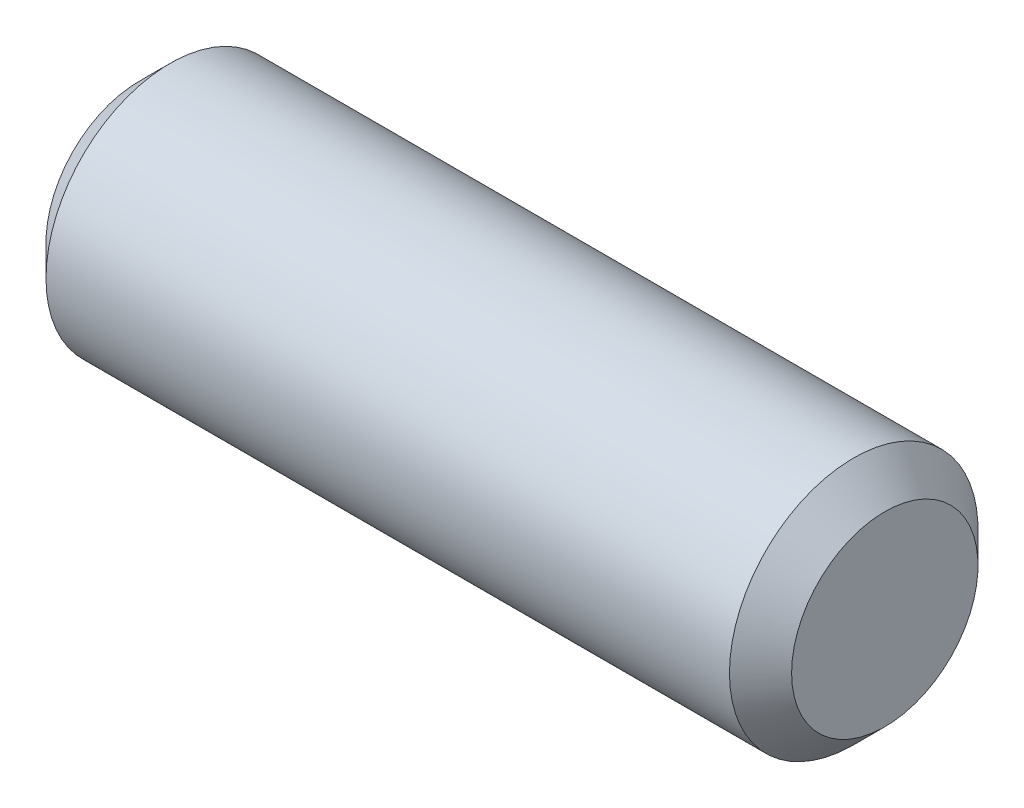
from build123d import *

# Parameters (mm, degrees)
SKETCH_1_W     = 24
SKETCH_1_H     = 4
CHAMFER_1_SIZE = 1


with BuildPart() as part:
    # 草圖1 → 旋轉1 (revolve)
    with BuildSketch(Plane.XY, mode=Mode.PRIVATE) as revolve_1_sk:
        with Locations((12, 2)):
            Rectangle(SKETCH_1_W, SKETCH_1_H)
    revolve(revolve_1_sk.sketch.rotate(Axis((0, 0, 0), (1, 0, 0)), 90), axis=Axis((0, 0, 0), (1, 0, 0)))

    # 導角1
    chamfer_1_edges = [part.edges().sort_by_distance(p)[0] for p in [
        (24, 0, -4),
        (0, 0, -4),
    ]]
    chamfer(chamfer_1_edges, length=CHAMFER_1_SIZE)


solid = part.part
